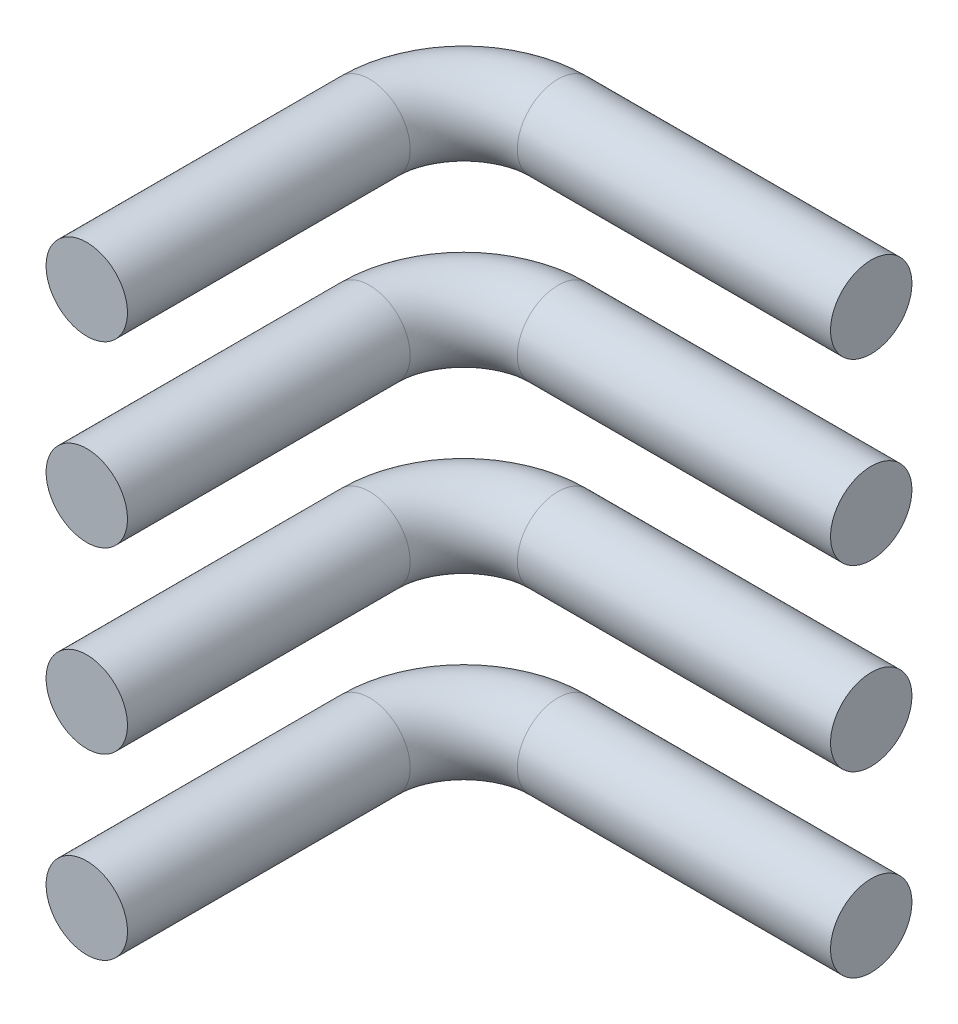
from build123d import *

# Parameters (mm, degrees)
SKETCH8_R = 2.159


with BuildPart() as part:
    # Sweep1: sweep along a curve in space
    with BuildLine() as sweep1_path:
        Line((0, 23.246956006, 20), (0, 23.246956006, 5))
        ThreePointArc((0, 23.246956006, 5), (1.464466094, 23.246956006, 1.464466094), (5, 23.246956006, 0))
        Line((5, 23.246956006, 0), (18.36665, 23.246956006, 0))
        Line((18.36665, 23.246956006, 0), (21.61665, 23.246956006, 0))
    # Sketch8 → Sweep1 (sweep)
    with BuildSketch(Plane(origin=(21.61665, 23.246956006, 0), x_dir=(0, 0, -1), z_dir=(1, 0, 0))):
        Circle(SKETCH8_R)
        with Locations((0, -9.4742)):
            Circle(SKETCH8_R)
        with Locations((0, -28.4226)):
            Circle(SKETCH8_R)
        with Locations((0, -18.9484)):
            Circle(SKETCH8_R)
    sweep(path=sweep1_path.line)


solid = part.part
